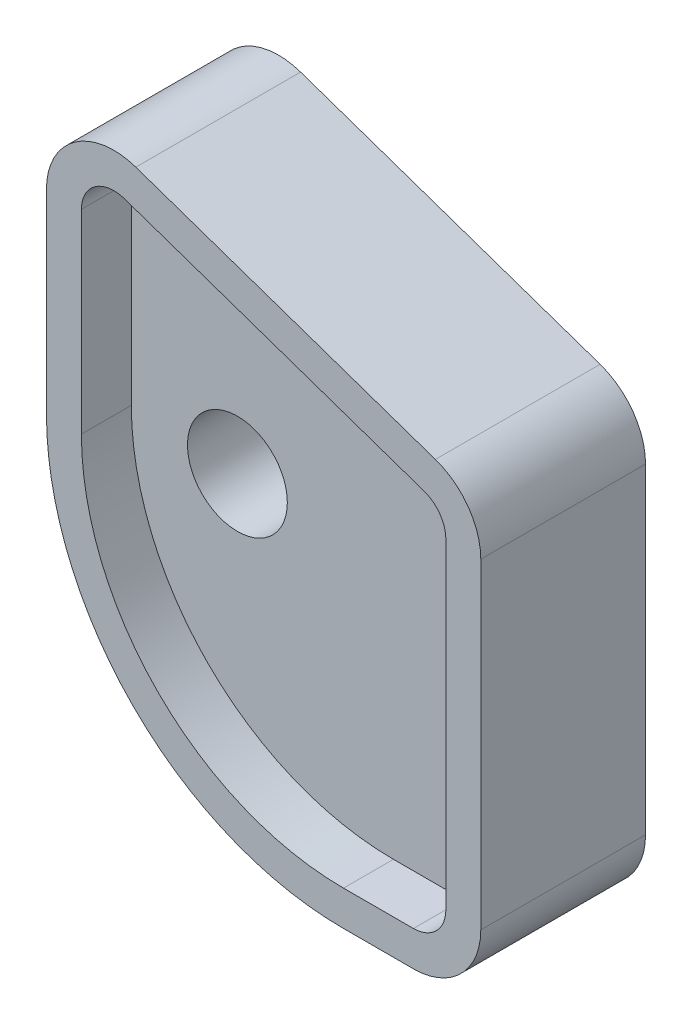
from build123d import *

# Parameters (mm, degrees)
SKETCH1_R           = 1
BOSS_EXTRUDE1_DEPTH = 3.3
CUT_EXTRUDE1_START  = -1
SKETCH2_R           = 1
CUT_EXTRUDE1_DEPTH  = 1


with BuildPart() as part:
    # Sketch1 → Boss-Extrude1 (new body)
    with BuildSketch(Plane.XY):
        with BuildLine():
            Line((-47.825, -19.975), (-47.825, -23.875))
            ThreePointArc((-47.825, -23.875), (-46.082285348, -28.082285348), (-41.875, -29.825))
            Line((-41.875, -29.825), (-40.475, -29.825))
            ThreePointArc((-40.475, -29.825), (-39.520405845, -29.429594155), (-39.125, -28.475))
            Line((-39.125, -28.475), (-39.125, -22.044366415))
            ThreePointArc((-39.125, -22.044366415), (-39.375745502, -21.260695854), (-40.034836368, -20.768139171))
            Line((-40.034836368, -20.768139171), (-46.034836368, -18.698772757))
            ThreePointArc((-46.034836368, -18.698772757), (-47.258670561, -18.875745502), (-47.825, -19.975))
        make_face()
        with Locations((-45, -24)):
            Circle(SKETCH1_R, mode=Mode.SUBTRACT)
    extrude(amount=BOSS_EXTRUDE1_DEPTH)

    # Sketch2 → Cut-Extrude1 (cut)
    with BuildSketch(Plane.XY.offset(3.3).offset(CUT_EXTRUDE1_START)):
        with BuildLine():
            Line((-40.263069362, -21.429886631), (-46.263069362, -19.360520216))
            ThreePointArc((-46.263069362, -19.360520216), (-46.852322863, -19.445729316), (-47.125, -19.975))
            Line((-47.125, -19.975), (-47.125, -23.875))
            ThreePointArc((-47.125, -23.875), (-45.587310601, -27.587310601), (-41.875, -29.125))
            Line((-41.875, -29.125), (-40.475, -29.125))
            ThreePointArc((-40.475, -29.125), (-40.015380592, -28.934619408), (-39.825, -28.475))
            Line((-39.825, -28.475), (-39.825, -22.044366415))
            ThreePointArc((-39.825, -22.044366415), (-39.945729316, -21.667043552), (-40.263069362, -21.429886631))
        make_face()
        with Locations((-45, -24)):
            Circle(SKETCH2_R, mode=Mode.SUBTRACT)
    extrude(amount=CUT_EXTRUDE1_DEPTH, mode=Mode.SUBTRACT)


solid = part.part
